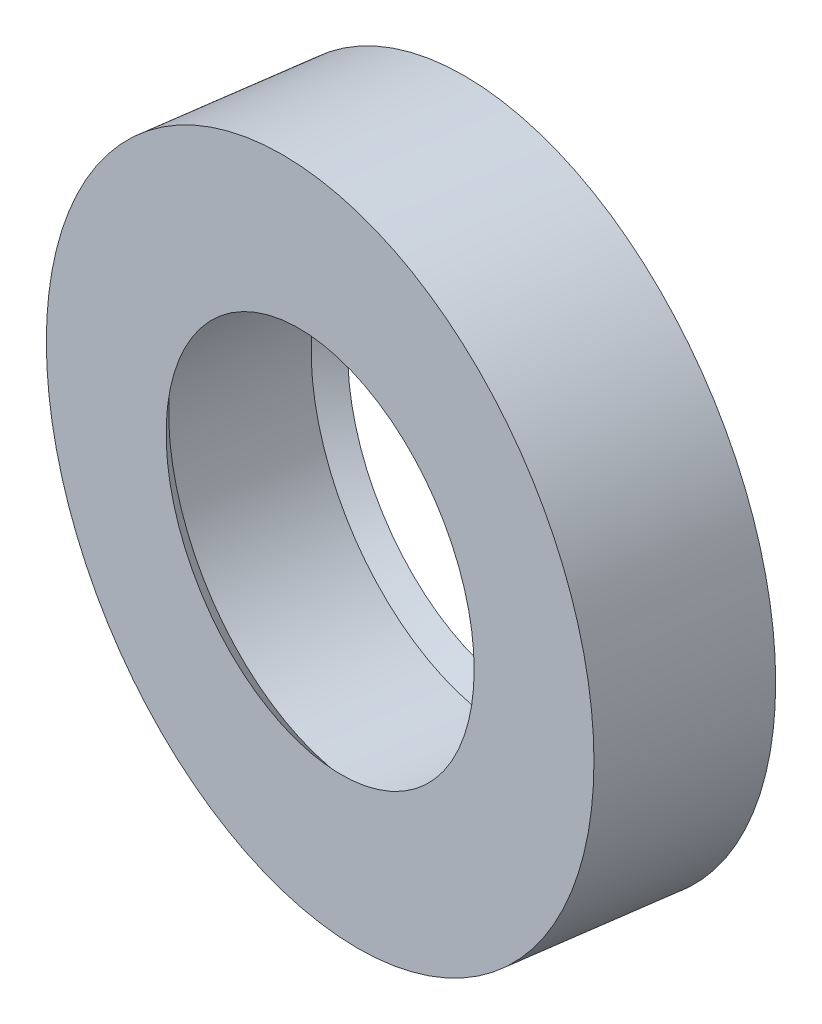
from build123d import *


with BuildPart() as part:
    # Sketch1 → Revolve1 (revolve)
    with BuildSketch(Plane(origin=(-20.172782733, 5.286355785, 55.643740063), x_dir=(0.139254831399095, 0, -0.9902565788380352), z_dir=(0.9444278759611343, -0.30069493816318704, 0.13281017005703089)), mode=Mode.PRIVATE) as revolve1_sk:
        Polygon((44.551681452, -18.27965516), (45.237481452, -19.07340516), (50.215881452, -19.07340516), (50.901681452, -18.27965516), (50.901681452, -19.07340516), (50.901681452, -23.83590516), (44.551681452, -23.83590516), (44.551681452, -19.07340516), align=None)
    revolve(revolve1_sk.sketch.rotate(Axis((-20.414371122, -5.334183863, 33.31578353), (0.13925483139909509, 0, -0.9902565788380352)), 252.500652508), axis=Axis((-20.414371122, -5.334183863, 33.31578353), (0.13925483139909509, 0, -0.9902565788380352)))


solid = part.part
